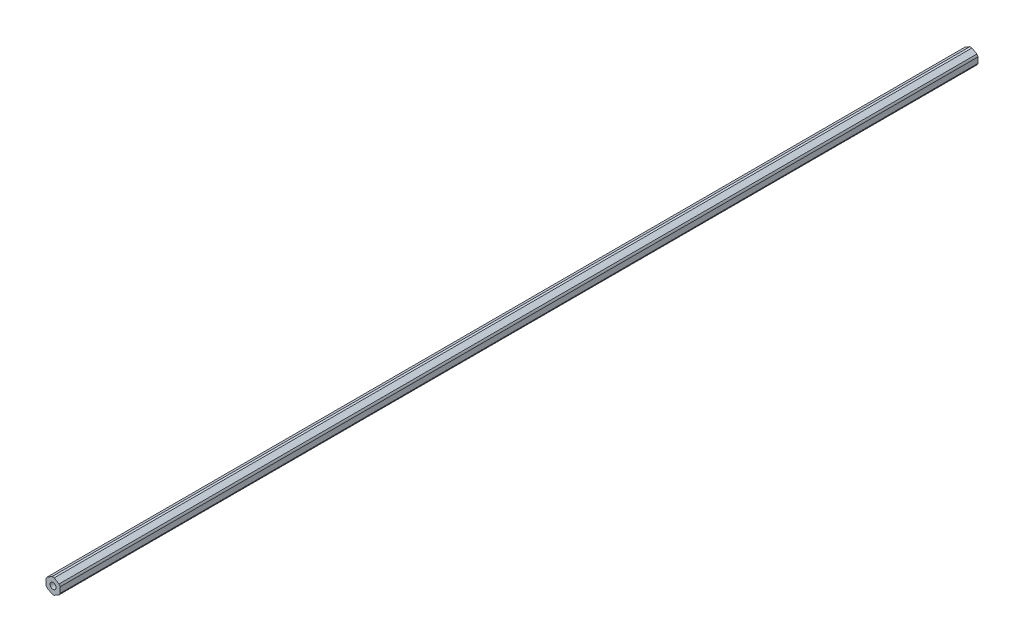
from build123d import *

# Parameters (mm, degrees)
SKETCH2_R                            = 2.0193
BOSS_EXTRUDE1_DEPTH                  = 307.975
F_10_32_TAPPED_HOLE2_D               = 4.0386
F_10_32_TAPPED_HOLE2_DEPTH           = 16.34744
F_10_32_TAPPED_HOLE2_TIP             = 1.213317848
F_10_32_TAPPED_HOLE2_ON_FACE_2_D     = 4.0386
F_10_32_TAPPED_HOLE2_ON_FACE_2_DEPTH = 16.34744
F_10_32_TAPPED_HOLE2_ON_FACE_2_TIP   = 1.213317848


with BuildPart() as part:
    # Sketch2 → Boss-Extrude1 (new, symmetric)
    with BuildSketch(Plane.XY):
        with BuildLine():
            ThreePointArc((0.741687758, 5.071047688), (0, 5.125000037), (-0.741687758, 5.071047688))
            Line((-0.741687758, 5.071047688), (-4.020812242, 3.177844283))
            ThreePointArc((-4.020812242, 3.177844283), (-4.438380226, 2.562500019), (-4.7625, 1.893203404))
            Line((-4.7625, 1.893203404), (-4.7625, -1.893203404))
            ThreePointArc((-4.7625, -1.893203404), (-4.438380226, -2.562500019), (-4.020812242, -3.177844283))
            Line((-4.020812242, -3.177844283), (-0.741687758, -5.071047688))
            ThreePointArc((-0.741687758, -5.071047688), (0, -5.125000037), (0.741687758, -5.071047688))
            Line((0.741687758, -5.071047688), (4.020812242, -3.177844283))
            ThreePointArc((4.020812242, -3.177844283), (4.438380226, -2.562500019), (4.7625, -1.893203404))
            Line((4.7625, -1.893203404), (4.7625, 1.893203404))
            ThreePointArc((4.7625, 1.893203404), (4.438380226, 2.562500019), (4.020812242, 3.177844283))
            Line((4.020812242, 3.177844283), (0.741687758, 5.071047688))
        make_face()
        Circle(SKETCH2_R, mode=Mode.SUBTRACT)
    extrude(amount=BOSS_EXTRUDE1_DEPTH, both=True)

    # #10-32 Tapped Hole2
    with Locations(Plane(origin=(0, 0, -307.975), x_dir=(-1, 0, 0), z_dir=(0, 0, -1))):
        with Locations((0, 0)):
            Hole(F_10_32_TAPPED_HOLE2_D / 2, depth=F_10_32_TAPPED_HOLE2_DEPTH)
            with Locations((0, 0, -(F_10_32_TAPPED_HOLE2_DEPTH + F_10_32_TAPPED_HOLE2_TIP / 2))):  # 118° drill point
                Cone(0, F_10_32_TAPPED_HOLE2_D / 2, F_10_32_TAPPED_HOLE2_TIP, mode=Mode.SUBTRACT)

    # #10-32 Tapped Hole2 on face 2
    with Locations(Plane(origin=(0, 0, 307.975), x_dir=(-1, 0, 0), z_dir=(0, 0, -1))):
        with Locations((0, 0)):
            Hole(F_10_32_TAPPED_HOLE2_ON_FACE_2_D / 2, depth=F_10_32_TAPPED_HOLE2_ON_FACE_2_DEPTH)
            with Locations((0, 0, -(F_10_32_TAPPED_HOLE2_ON_FACE_2_DEPTH + F_10_32_TAPPED_HOLE2_ON_FACE_2_TIP / 2))):  # 118° drill point
                Cone(0, F_10_32_TAPPED_HOLE2_ON_FACE_2_D / 2, F_10_32_TAPPED_HOLE2_ON_FACE_2_TIP, mode=Mode.SUBTRACT)


solid = part.part
